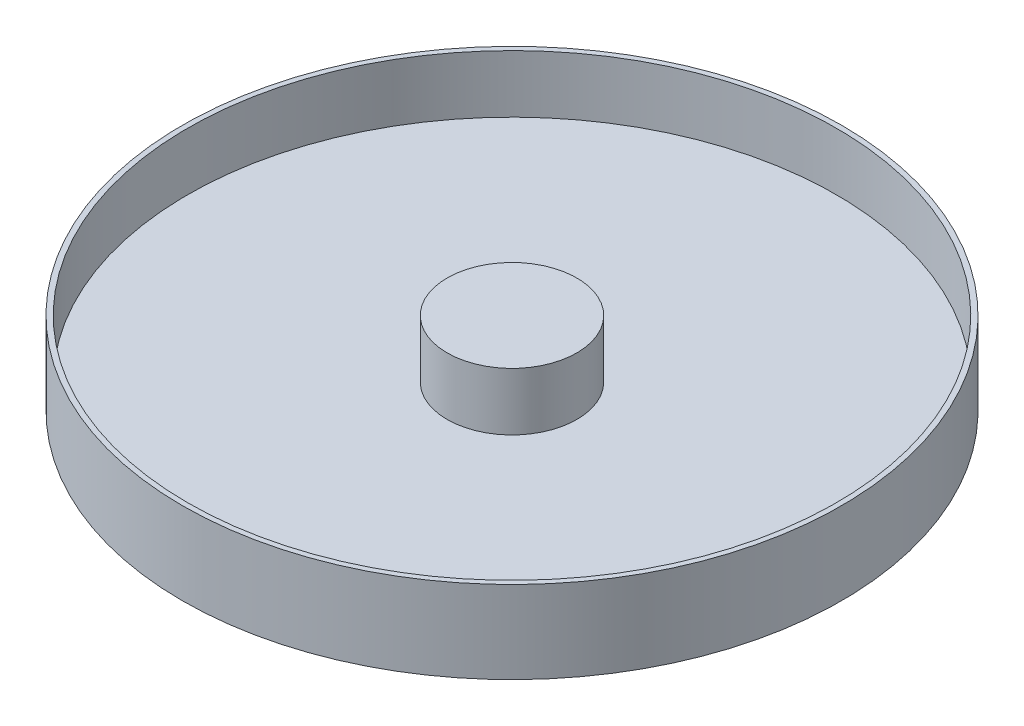
from build123d import *

# Parameters (mm, degrees)
SKETCH1_R           = 80
SKETCH1_R_2         = 78.75
BOSS_EXTRUDE1_DEPTH = 20
SKETCH1_3_R         = 15.75
BOSS_EXTRUDE2_DEPTH = 20
SKETCH1_4_R         = 78.75
SKETCH1_4_R_2       = 15.75
BOSS_EXTRUDE3_DEPTH = 6


with BuildPart() as part:
    # Sketch1 → Boss-Extrude1 (new body)
    with BuildSketch(Plane(origin=(0, 0, 0), x_dir=(1, 0, 0), z_dir=(0, 1, 0))):
        Circle(SKETCH1_R)
        Circle(SKETCH1_R_2, mode=Mode.SUBTRACT)
    extrude(amount=BOSS_EXTRUDE1_DEPTH)



with BuildPart() as body_2:
    # Sketch1<3> → Boss-Extrude2 (new body)
    with BuildSketch(Plane(origin=(0, 0, 0), x_dir=(1, 0, 0), z_dir=(0, 1, 0))):
        Circle(SKETCH1_3_R)
    extrude(amount=BOSS_EXTRUDE2_DEPTH)


with BuildPart() as part_1:
    add(part.part)

    add(body_2.part)  # Boss-Extrude3 merges body 2
    # Sketch1<4> → Boss-Extrude3 (add)
    with BuildSketch(Plane(origin=(0, 0, 0), x_dir=(1, 0, 0), z_dir=(0, 1, 0))):
        Circle(SKETCH1_4_R)
        Circle(SKETCH1_4_R_2, mode=Mode.SUBTRACT)
    extrude(amount=BOSS_EXTRUDE3_DEPTH)


solid = part_1.part
